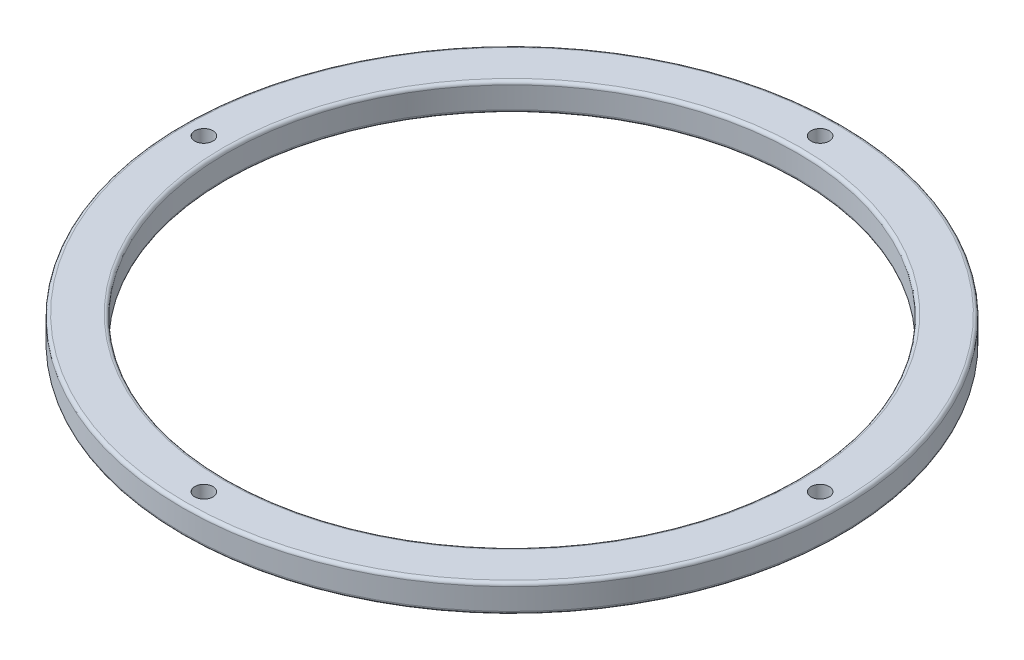
from build123d import *

# Parameters (mm, degrees)
SKETCH1_R           = 100
SKETCH1_R_2         = 86.5
BOSS_EXTRUDE1_DEPTH = 8.5
FILLET1_R           = 1
SKETCH2_R           = 2.75
CUT_EXTRUDE1_DEPTH  = 142.676568423


with BuildPart() as part:
    # Sketch1 → Boss-Extrude1 (new body)
    with BuildSketch(Plane(origin=(0, 0, 0), x_dir=(1, 0, 0), z_dir=(0, 1, 0))):
        with Locations(Location((0, 0, 0), (0, 0, 270))):
            Circle(SKETCH1_R)
        with Locations(Location((0, 0, 0), (0, 0, 270))):
            Circle(SKETCH1_R_2, mode=Mode.SUBTRACT)
    extrude(amount=BOSS_EXTRUDE1_DEPTH)

    # Fillet1
    fillet1_edges = [part.edges().sort_by_distance(p)[0] for p in [
        (0, 0, -100),
        (0, 8.5, -100),
        (0, 0, -86.5),
        (0, 8.5, -86.5),
    ]]
    fillet(fillet1_edges, radius=FILLET1_R)

    # Sketch2 → Cut-Extrude1 (cut, through all)
    with BuildSketch(Plane(origin=(0, 8.5, 0), x_dir=(1, 0, 0), z_dir=(0, 1, 0))):
        with Locations(Location((0, 93.5, 0), (0, 0, 270))):
            Circle(SKETCH2_R)
        with Locations(Location((93.5, 0, 0), (0, 0, 270))):
            Circle(SKETCH2_R)
        with Locations(Location((0, -93.5, 0), (0, 0, 270))):
            Circle(SKETCH2_R)
        with Locations(Location((-93.5, 0, 0), (0, 0, 270))):
            Circle(SKETCH2_R)
    extrude(amount=-CUT_EXTRUDE1_DEPTH, mode=Mode.SUBTRACT)


solid = part.part
